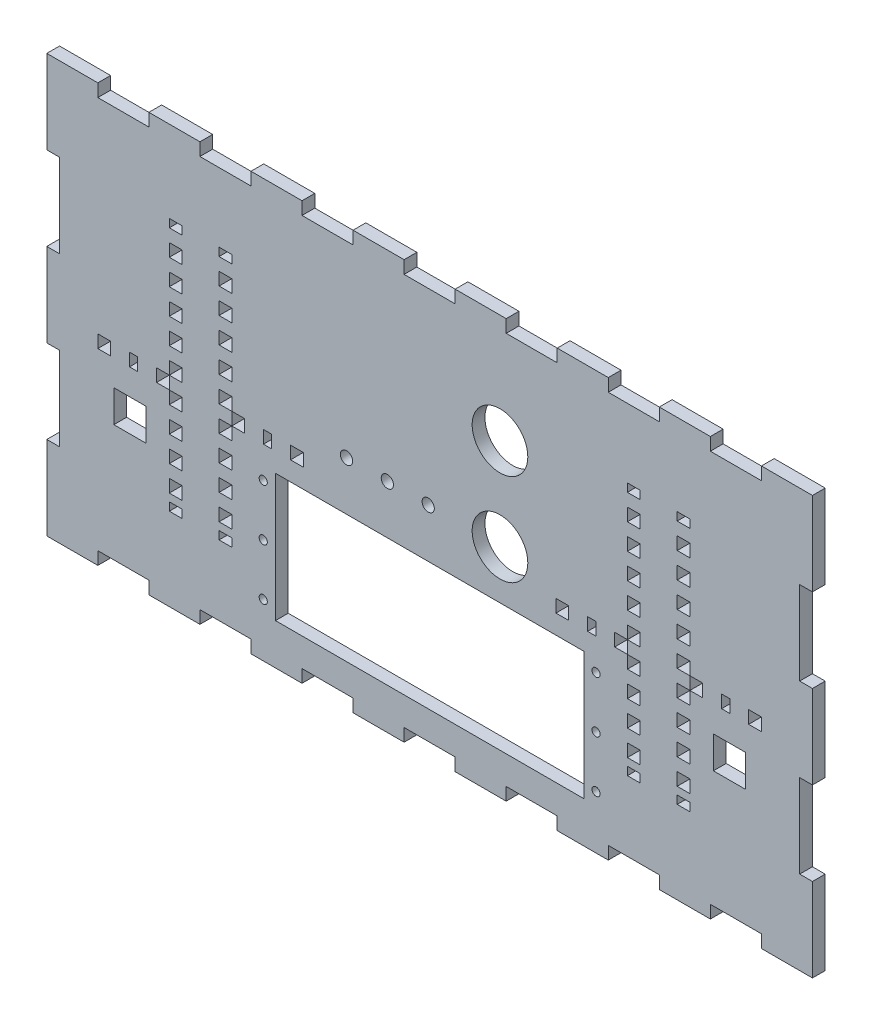
from build123d import *

# Parameters (mm, degrees)
SKETCH1_W           = 381
SKETCH1_H           = 207.9625
SKETCH1_R           = 3.048
SKETCH1_R_2         = 13.843
SKETCH1_R_3         = 2.032
SKETCH1_W_2         = 153.416
SKETCH1_H_2         = 63.5
SKETCH1_W_3         = 6.35
SKETCH1_H_3         = 6.35
SKETCH1_W_4         = 4.064
SKETCH1_H_4         = 4.064
BOSS_EXTRUDE1_DEPTH = 6.35
SKETCH2_W           = 25.4
SKETCH2_H           = 6.35
SKETCH2_W_2         = 6.35
SKETCH2_H_2         = 41.5925
CUT_EXTRUDE2_DEPTH  = 6.35
SKETCH3_W           = 15.927273935
SKETCH3_H           = 15.927273935
CUT_EXTRUDE3_DEPTH  = 6.35


with BuildPart() as part:
    # Sketch1 → Boss-Extrude1 (new body)
    with BuildSketch(Plane.XY):
        Rectangle(SKETCH1_W, SKETCH1_H)
        with Locations((-41.351226957, 4.251574204)):
            Circle(SKETCH1_R, mode=Mode.SUBTRACT)
        with Locations((-21.031226957, 4.251574204)):
            Circle(SKETCH1_R, mode=Mode.SUBTRACT)
        with Locations((-0.711226957, 4.251574204)):
            Circle(SKETCH1_R, mode=Mode.SUBTRACT)
        with Locations((35.014497525, 4.064399301)):
            Circle(SKETCH1_R_2, mode=Mode.SUBTRACT)
        with Locations((35.014497525, 49.784399301)):
            Circle(SKETCH1_R_2, mode=Mode.SUBTRACT)
        with Locations((-82.804, -51.816)):
            Circle(SKETCH1_R_3, mode=Mode.SUBTRACT)
        with Locations((82.804, -51.816)):
            Circle(SKETCH1_R_3, mode=Mode.SUBTRACT)
        with Locations((-82.804, -26.162)):
            Circle(SKETCH1_R_3, mode=Mode.SUBTRACT)
        with Locations((82.804, -26.162)):
            Circle(SKETCH1_R_3, mode=Mode.SUBTRACT)
        with Locations((82.804, -77.47)):
            Circle(SKETCH1_R_3, mode=Mode.SUBTRACT)
        with Locations((-82.804, -77.47)):
            Circle(SKETCH1_R_3, mode=Mode.SUBTRACT)
        with Locations((0, -51.816)):
            Rectangle(SKETCH1_W_2, SKETCH1_H_2, mode=Mode.SUBTRACT)
        with Locations((161.925, -7.366)):
            Rectangle(SKETCH1_W_3, SKETCH1_H_3, mode=Mode.SUBTRACT)
        with Locations((-161.925, -7.366)):
            Rectangle(SKETCH1_W_3, SKETCH1_H_3, mode=Mode.SUBTRACT)
        with Locations((-126.365, 11.65225)):
            Rectangle(SKETCH1_W_3, SKETCH1_H_3, mode=Mode.SUBTRACT)
        with Locations((-126.365, 24.35225)):
            Rectangle(SKETCH1_W_3, SKETCH1_H_3, mode=Mode.SUBTRACT)
        with Locations((-126.365, 37.05225)):
            Rectangle(SKETCH1_W_3, SKETCH1_H_3, mode=Mode.SUBTRACT)
        with Locations((-147.32, -7.366)):
            Rectangle(SKETCH1_W_4, SKETCH1_H_3, mode=Mode.SUBTRACT)
        Polygon((-123.19, -4.22275), (-129.54, -4.22275), (-129.54, -10.541), (-135.89, -10.541), (-135.89, -4.191), (-129.54, -4.191), (-129.54, 2.12725), (-123.19, 2.12725), align=None, mode=Mode.SUBTRACT)
        with Locations((-126.365, -13.74775)):
            Rectangle(SKETCH1_W_3, SKETCH1_H_3, mode=Mode.SUBTRACT)
        with Locations((-126.365, -26.44775)):
            Rectangle(SKETCH1_W_3, SKETCH1_H_3, mode=Mode.SUBTRACT)
        with Locations((-126.365, -39.14775)):
            Rectangle(SKETCH1_W_3, SKETCH1_H_3, mode=Mode.SUBTRACT)
        with Locations((-126.365, -51.84775)):
            Rectangle(SKETCH1_W_3, SKETCH1_H_3, mode=Mode.SUBTRACT)
        with Locations((-126.365, -60.80125)):
            Rectangle(SKETCH1_W_3, SKETCH1_H_4, mode=Mode.SUBTRACT)
        with Locations((-126.365, 49.75225)):
            Rectangle(SKETCH1_W_3, SKETCH1_H_3, mode=Mode.SUBTRACT)
        with Locations((-126.365, 61.30925)):
            Rectangle(SKETCH1_W_3, SKETCH1_H_4, mode=Mode.SUBTRACT)
        with Locations((-101.6, 61.30925)):
            Rectangle(SKETCH1_W_3, SKETCH1_H_4, mode=Mode.SUBTRACT)
        Polygon((104.775, 2.12725), (104.775, -4.22275), (98.425, -4.22275), (98.425, -10.541), (92.075, -10.541), (92.075, -4.191), (98.425, -4.191), (98.425, 2.12725), align=None, mode=Mode.SUBTRACT)
        with Locations((80.645, -7.366)):
            Rectangle(SKETCH1_W_4, SKETCH1_H_3, mode=Mode.SUBTRACT)
        with Locations((66.04, -7.366)):
            Rectangle(SKETCH1_W_3, SKETCH1_H_3, mode=Mode.SUBTRACT)
        with Locations((101.6, 11.65225)):
            Rectangle(SKETCH1_W_3, SKETCH1_H_3, mode=Mode.SUBTRACT)
        with Locations((101.6, -13.74775)):
            Rectangle(SKETCH1_W_3, SKETCH1_H_3, mode=Mode.SUBTRACT)
        with Locations((101.6, -26.44775)):
            Rectangle(SKETCH1_W_3, SKETCH1_H_3, mode=Mode.SUBTRACT)
        with Locations((101.6, -39.14775)):
            Rectangle(SKETCH1_W_3, SKETCH1_H_3, mode=Mode.SUBTRACT)
        with Locations((101.6, -51.84775)):
            Rectangle(SKETCH1_W_3, SKETCH1_H_3, mode=Mode.SUBTRACT)
        with Locations((101.6, -60.80125)):
            Rectangle(SKETCH1_W_3, SKETCH1_H_4, mode=Mode.SUBTRACT)
        with Locations((126.365, -13.74775)):
            Rectangle(SKETCH1_W_3, SKETCH1_H_3, mode=Mode.SUBTRACT)
        with Locations((147.32, -7.366)):
            Rectangle(SKETCH1_W_4, SKETCH1_H_3, mode=Mode.SUBTRACT)
        with Locations((-66.04, -7.366)):
            Rectangle(SKETCH1_W_3, SKETCH1_H_3, mode=Mode.SUBTRACT)
        with Locations((126.365, 61.30925)):
            Rectangle(SKETCH1_W_3, SKETCH1_H_4, mode=Mode.SUBTRACT)
        with Locations((101.6, 24.35225)):
            Rectangle(SKETCH1_W_3, SKETCH1_H_3, mode=Mode.SUBTRACT)
        with Locations((101.6, 37.05225)):
            Rectangle(SKETCH1_W_3, SKETCH1_H_3, mode=Mode.SUBTRACT)
        with Locations((101.6, 49.75225)):
            Rectangle(SKETCH1_W_3, SKETCH1_H_3, mode=Mode.SUBTRACT)
        with Locations((101.6, 61.30925)):
            Rectangle(SKETCH1_W_3, SKETCH1_H_4, mode=Mode.SUBTRACT)
        with Locations((126.365, 49.75225)):
            Rectangle(SKETCH1_W_3, SKETCH1_H_3, mode=Mode.SUBTRACT)
        with Locations((126.365, 37.05225)):
            Rectangle(SKETCH1_W_3, SKETCH1_H_3, mode=Mode.SUBTRACT)
        with Locations((126.365, 24.35225)):
            Rectangle(SKETCH1_W_3, SKETCH1_H_3, mode=Mode.SUBTRACT)
        with Locations((126.365, 11.65225)):
            Rectangle(SKETCH1_W_3, SKETCH1_H_3, mode=Mode.SUBTRACT)
        with Locations((-80.645, -7.366)):
            Rectangle(SKETCH1_W_4, SKETCH1_H_3, mode=Mode.SUBTRACT)
        Polygon((-104.775, 2.12725), (-104.775, -4.22275), (-98.425, -4.22275), (-98.425, -10.541), (-92.075, -10.541), (-92.075, -4.191), (-98.425, -4.191), (-98.425, 2.12725), align=None, mode=Mode.SUBTRACT)
        with Locations((-101.6, -13.74775)):
            Rectangle(SKETCH1_W_3, SKETCH1_H_3, mode=Mode.SUBTRACT)
        with Locations((-101.6, -26.44775)):
            Rectangle(SKETCH1_W_3, SKETCH1_H_3, mode=Mode.SUBTRACT)
        with Locations((-101.6, -39.14775)):
            Rectangle(SKETCH1_W_3, SKETCH1_H_3, mode=Mode.SUBTRACT)
        with Locations((-101.6, -51.84775)):
            Rectangle(SKETCH1_W_3, SKETCH1_H_3, mode=Mode.SUBTRACT)
        Polygon((123.19, -4.22275), (129.54, -4.22275), (129.54, -10.541), (135.89, -10.541), (135.89, -4.191), (129.54, -4.191), (129.54, 2.12725), (123.19, 2.12725), align=None, mode=Mode.SUBTRACT)
        with Locations((126.365, -26.44775)):
            Rectangle(SKETCH1_W_3, SKETCH1_H_3, mode=Mode.SUBTRACT)
        with Locations((126.365, -39.14775)):
            Rectangle(SKETCH1_W_3, SKETCH1_H_3, mode=Mode.SUBTRACT)
        with Locations((126.365, -51.84775)):
            Rectangle(SKETCH1_W_3, SKETCH1_H_3, mode=Mode.SUBTRACT)
        with Locations((126.365, -60.80125)):
            Rectangle(SKETCH1_W_3, SKETCH1_H_4, mode=Mode.SUBTRACT)
        with Locations((-101.6, -60.80125)):
            Rectangle(SKETCH1_W_3, SKETCH1_H_4, mode=Mode.SUBTRACT)
        with Locations((-101.6, 49.75225)):
            Rectangle(SKETCH1_W_3, SKETCH1_H_3, mode=Mode.SUBTRACT)
        with Locations((-101.6, 37.05225)):
            Rectangle(SKETCH1_W_3, SKETCH1_H_3, mode=Mode.SUBTRACT)
        with Locations((-101.6, 24.35225)):
            Rectangle(SKETCH1_W_3, SKETCH1_H_3, mode=Mode.SUBTRACT)
        with Locations((-101.6, 11.65225)):
            Rectangle(SKETCH1_W_3, SKETCH1_H_3, mode=Mode.SUBTRACT)
    extrude(amount=BOSS_EXTRUDE1_DEPTH)

    # Sketch2 → Cut-Extrude2 (cut)
    with BuildSketch(Plane.XY):
        with Locations((-152.4, 100.80625)):
            Rectangle(SKETCH2_W, SKETCH2_H)
        with Locations((-101.6, 100.80625)):
            Rectangle(SKETCH2_W, SKETCH2_H)
        with Locations((-50.8, 100.80625)):
            Rectangle(SKETCH2_W, SKETCH2_H)
        with Locations((0, 100.80625)):
            Rectangle(SKETCH2_W, SKETCH2_H)
        with Locations((50.8, 100.80625)):
            Rectangle(SKETCH2_W, SKETCH2_H)
        with Locations((152.4, 100.80625)):
            Rectangle(SKETCH2_W, SKETCH2_H)
        with Locations((101.6, 100.80625)):
            Rectangle(SKETCH2_W, SKETCH2_H)
        with Locations((187.325, 41.5925)):
            Rectangle(SKETCH2_W_2, SKETCH2_H_2)
        with Locations((187.325, -41.5925)):
            Rectangle(SKETCH2_W_2, SKETCH2_H_2)
        with Locations((152.4, -100.80625)):
            Rectangle(SKETCH2_W, SKETCH2_H)
        with Locations((50.8, -100.80625)):
            Rectangle(SKETCH2_W, SKETCH2_H)
        with Locations((0, -100.80625)):
            Rectangle(SKETCH2_W, SKETCH2_H)
        with Locations((-50.8, -100.80625)):
            Rectangle(SKETCH2_W, SKETCH2_H)
        with Locations((-101.6, -100.80625)):
            Rectangle(SKETCH2_W, SKETCH2_H)
        with Locations((-152.4, -100.80625)):
            Rectangle(SKETCH2_W, SKETCH2_H)
        with Locations((-187.325, -41.5925)):
            Rectangle(SKETCH2_W_2, SKETCH2_H_2)
        with Locations((-187.325, 41.5925)):
            Rectangle(SKETCH2_W_2, SKETCH2_H_2)
        with Locations((101.6, -100.80625)):
            Rectangle(SKETCH2_W, SKETCH2_H)
    extrude(amount=CUT_EXTRUDE2_DEPTH, mode=Mode.SUBTRACT)

    # Sketch3 → Cut-Extrude3 (cut)
    with BuildSketch(Plane.XY.offset(6.35)):
        with Locations((-149.169137385, -31.379040491)):
            Rectangle(SKETCH3_W, SKETCH3_H)
        with Locations((149.169137385, -31.379040491)):
            Rectangle(SKETCH3_W, SKETCH3_H)
    extrude(amount=-CUT_EXTRUDE3_DEPTH, mode=Mode.SUBTRACT)


solid = part.part
